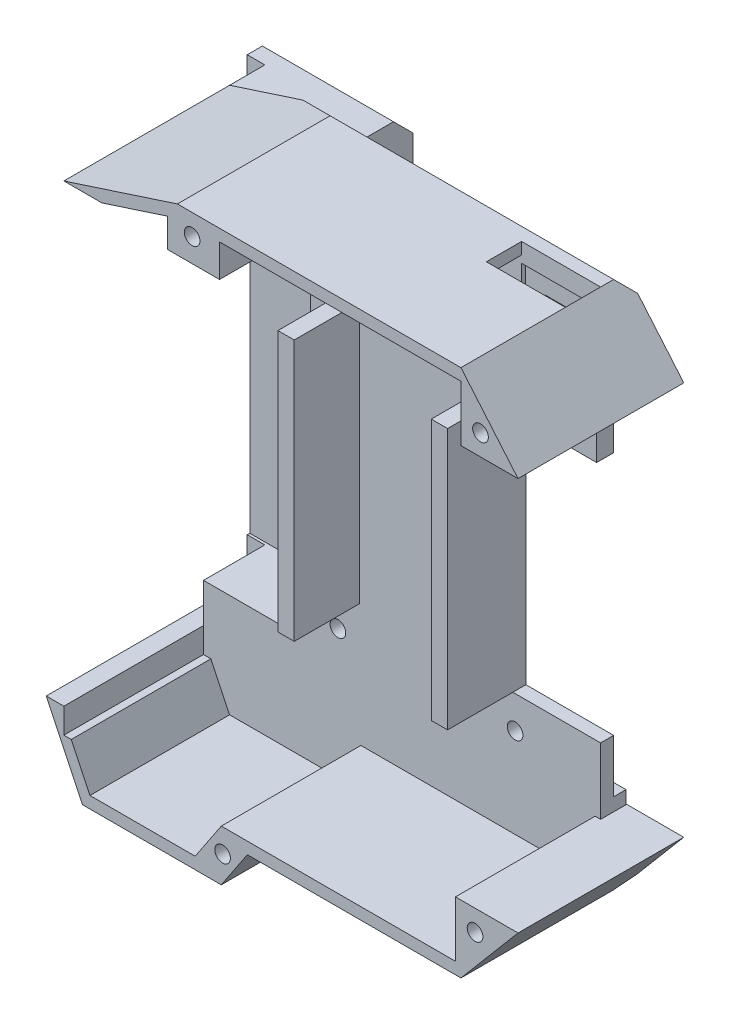
from build123d import *

# Parameters (mm, degrees)
SKETCH_1_W          = 33.55
SKETCH_1_H          = 60.3
SKETCH_1_R          = 1.2
EXTRUDE_1_DEPTH     = 2
SKETCH_2_W          = 2
SKETCH_2_H          = 60.3
EXTRUDE_2_DEPTH     = 9.9
SKETCH_3_W          = 9.9
SKETCH_3_H          = 2
EXTRUDE_3_DEPTH     = 1.9
SKETCH_4_W          = 10.719852834
SKETCH_4_H          = 56.3
SKETCH_4_W_2        = 2
SKETCH_4_H_2        = 60.3
EXTRUDE_5_DEPTH     = 3
SKETCH_6_W          = 14.719852834
SKETCH_6_H          = 4.7
EXTRUDE_6_DEPTH     = 3
SKETCH_7_W          = 9.4
SKETCH_7_H          = 6
SKETCH_7_R          = 1.5
EXTRUDE_7_DEPTH     = 14.4
EXTRUDE_8_DEPTH     = 17.1
EXTRUDE_9_DEPTH     = 8.35
SKETCH_10_W         = 43.45
SKETCH_10_H         = 4
EXTRUDE_10_DEPTH    = 8.35
CUT_EXTRUDE_START   = -0.6
CUT_EXTRUDE_1_DEPTH = 0.6
CUT_EXTRUDE_2_DEPTH = 0.6
SKETCH_13_W         = 43.45
SKETCH_13_H         = 4
EXTRUDE_11_DEPTH    = 2
SKETCH_14_W         = 43.45
SKETCH_14_H         = 4
EXTRUDE_12_DEPTH    = 2
EXTRUDE_13_DEPTH    = 4
SKETCH_16_W         = 2.5
SKETCH_16_H         = 40
EXTRUDE_14_DEPTH    = 10
SKETCH_17_W         = 4
SKETCH_17_H         = 5.65
EXTRUDE_15_DEPTH    = 17.4
EXTRUDE_16_DEPTH    = 4
SKETCH_19_W         = 1.8
SKETCH_19_H         = 1.8
EXTRUDE_17_DEPTH    = 21.4
SKETCH_20_W         = 12.1
SKETCH_20_H         = 1.8
EXTRUDE_18_DEPTH    = 16
EXTRUDE_START       = -4
EXTRUDE_22_DEPTH    = 25.4
EXTRUDE_23_DEPTH    = 25.4
CUT_EXTRUDE_3_DEPTH = 21.4
EXTRUDE_24_DEPTH    = 4
EXTRUDE_25_DEPTH    = 21.4
SKETCH_26_W         = 1.445945033
SKETCH_26_H         = 2.5
EXTRUDE_26_DEPTH    = 10
EXTRUDE_27_DEPTH    = 21.4
EXTRUDE_28_DEPTH    = 21.4
SKETCH_29_W         = 21.4
SKETCH_29_H         = 5
EXTRUDE_29_DEPTH    = 3
SKETCH_30_R         = 1.2
CUT_EXTRUDE_4_DEPTH = 12
SKETCH_31_W         = 13.445945033
SKETCH_31_H         = 37.5
SKETCH_31_W_2       = 7.004054967
SKETCH_31_H_2       = 40
CUT_EXTRUDE_5_DEPTH = 2
CUT_EXTRUDE_START_2 = -9.4
CUT_EXTRUDE_6_DEPTH = 9.4
CHAMFER_2_SIZE      = 2
CHAMFER_3_SIZE      = 3
CHAMFER_4_SIZE      = 3


with BuildPart() as part:
    # 草图1 → 凸台-拉伸1 (new body)
    with BuildSketch(Plane.XY):
        with Locations((-131.125, 30.15)):
            Rectangle(SKETCH_1_W, SKETCH_1_H)
        with Locations((-144.7, 5.2)):
            Circle(SKETCH_1_R, mode=Mode.SUBTRACT)
        with Locations((-117.55, 5.2)):
            Circle(SKETCH_1_R, mode=Mode.SUBTRACT)
        with Locations((-117.55, 55.1)):
            Circle(SKETCH_1_R, mode=Mode.SUBTRACT)
        with Locations((-144.7, 55.1)):
            Circle(SKETCH_1_R, mode=Mode.SUBTRACT)
    extrude(amount=EXTRUDE_1_DEPTH)

    # 草图2 → 凸台-拉伸2 (add)
    with BuildSketch(Plane(origin=(-114.35, 0, 0), x_dir=(0, 0, -1), z_dir=(1, 0, 0))):
        with Locations((-1, 30.15)):
            Rectangle(SKETCH_2_W, SKETCH_2_H)
    extrude(amount=EXTRUDE_2_DEPTH)

    # 草图3 → 凸台-拉伸3 (add)
    with BuildSketch(Plane(origin=(0, 0, 0), x_dir=(-1, 0, 0), z_dir=(0, 0, -1))):
        with Locations((109.4, 59.3)):
            Rectangle(SKETCH_3_W, SKETCH_3_H)
        with Locations((109.4, 1)):
            Rectangle(SKETCH_3_W, SKETCH_3_H)
    extrude(amount=EXTRUDE_3_DEPTH)

    # 草图4 → 凸台-拉伸5 (add)
    with BuildSketch(Plane.ZY.offset(147.9)):
        Polygon((0, 60.3), (-12.719852834, 60.3), (-12.719852834, 58.3), (-2, 58.3), (-2, 2), (-12.719852834, 2), (-12.719852834, 0), (0, 0), align=None)
        with Locations((-7.359926417, 30.15)):
            Rectangle(SKETCH_4_W, SKETCH_4_H)
        with Locations((1, 30.15)):
            Rectangle(SKETCH_4_W_2, SKETCH_4_H_2)
    extrude(amount=EXTRUDE_5_DEPTH)

    # 草图6 → 凸台-拉伸6 (add)
    with BuildSketch(Plane.ZY.offset(150.9)):
        with Locations((-5.359926417, 62.65)):
            Rectangle(SKETCH_6_W, SKETCH_6_H)
        with Locations((-5.359926417, -2.35)):
            Rectangle(SKETCH_6_W, SKETCH_6_H)
    extrude(amount=-EXTRUDE_6_DEPTH)

    # 草图7 → 凸台-拉伸7 (add)
    # profile 1 of 2: a face of its own
    with BuildSketch(Plane.ZY.offset(150.9)):
        with Locations((-2.7, 62)):
            Rectangle(SKETCH_7_W, SKETCH_7_H)
        with Locations(Location((-4.3, 61.9, 0), (0, 0, 180))):
            Circle(SKETCH_7_R, mode=Mode.SUBTRACT)
    # profile 2 of 2: a face of its own
    with BuildSketch(Plane.ZY.offset(150.9)):
        with Locations((-2.7, -1.7)):
            Rectangle(SKETCH_7_W, SKETCH_7_H)
        with Locations(Location((-4.3, -1.6, 0), (0, 0, 180))):
            Circle(SKETCH_7_R, mode=Mode.SUBTRACT)
    extrude(amount=EXTRUDE_7_DEPTH)

    # 草图8 → 凸台-拉伸8 (add)
    with BuildSketch(Plane.ZY.offset(150.9)):
        Polygon((-7.8, 59), (-7.8, 1.3), (-7.4, 1.3), (-7.4, -4.7), (-12.719852834, -4.7), (-12.719852834, 65), (-7.4, 65), (-7.4, 59), align=None)
    extrude(amount=EXTRUDE_8_DEPTH)

    # 草图9 → 凸台-拉伸9 (add)
    with BuildSketch(Plane(origin=(0, 60.3, 0), x_dir=(1, 0, 0), z_dir=(0, 1, 0))):
        Polygon((-114.35, 1.9), (-114.35, 0), (-147.9, 0), (-147.9, -2), (-104.45, -2), (-104.45, 1.9), align=None)
        Polygon((-114.35, 1.9), (-104.45, 1.9), (-104.45, 2), (-147.9, 2), (-147.9, 0), (-114.35, 0), align=None)
    extrude(amount=EXTRUDE_9_DEPTH)

    # 草图10 → 凸台-拉伸10 (add)
    with BuildSketch(Plane.XZ):
        with Locations((-126.175, 0)):
            Rectangle(SKETCH_10_W, SKETCH_10_H)
    extrude(amount=EXTRUDE_10_DEPTH)

    # 草图11 → 切除-拉伸1 (cut)
    with BuildSketch(Plane.XY.offset(2).offset(CUT_EXTRUDE_START)):
        with BuildLine():
            Line((-104.45, 51.65), (-104.45, 67.75))
            Line((-104.45, 67.75), (-116.55, 67.75))
            Line((-116.55, 67.75), (-116.55, 55.763324958))
            ThreePointArc((-116.55, 55.763324958), (-116.354567134, 55.204595711), (-116.45, 54.620416848))
            Line((-116.45, 54.620416848), (-116.45, 51.65))
            Line((-116.45, 51.65), (-104.45, 51.65))
        make_face()
    extrude(amount=CUT_EXTRUDE_1_DEPTH, mode=Mode.SUBTRACT)

    # 草图12 → 切除-拉伸2 (cut)
    with BuildSketch(Plane.XY.offset(1.4)):
        with BuildLine():
            Line((-113.374176728, 54.65), (-107.45, 54.65))
            Line((-107.45, 54.65), (-107.45, 64.75))
            Line((-107.45, 64.75), (-113.55, 64.75))
            Line((-113.55, 64.75), (-113.55, 56.380624847))
            ThreePointArc((-113.55, 56.380624847), (-113.371508988, 55.524514858), (-113.374176728, 54.65))
        make_face()
    extrude(amount=-CUT_EXTRUDE_2_DEPTH, mode=Mode.SUBTRACT)

    # 草图13 → 凸台-拉伸11 (add)
    with BuildSketch(Plane(origin=(0, 68.65, 0), x_dir=(1, 0, 0), z_dir=(0, 1, 0))):
        with Locations((-126.175, 0)):
            Rectangle(SKETCH_13_W, SKETCH_13_H)
    extrude(amount=EXTRUDE_11_DEPTH)

    # 草图14 → 凸台-拉伸12 (add)
    with BuildSketch(Plane.XZ.offset(8.35)):
        with Locations((-126.175, 0)):
            Rectangle(SKETCH_14_W, SKETCH_14_H)
    extrude(amount=EXTRUDE_12_DEPTH)

    # 草图15 → 凸台-拉伸13 (add)
    with BuildSketch(Plane.XY.offset(2)):
        Polygon((-147.9, 70.65), (-165.3, 65), (-147.9, 65), align=None)
    extrude(amount=-EXTRUDE_13_DEPTH)

    # 草图16 → 凸台-拉伸14 (add)
    with BuildSketch(Plane.XY.offset(2)):
        with Locations((-142.645945033, 30.15)):
            Rectangle(SKETCH_16_W, SKETCH_16_H)
        with Locations((-119.145945033, 30.15)):
            Rectangle(SKETCH_16_W, SKETCH_16_H)
    extrude(amount=EXTRUDE_14_DEPTH)

    # 草图17 → 凸台-拉伸15 (add)
    with BuildSketch(Plane.ZY.offset(147.9)):
        with Locations((0, -7.525)):
            Rectangle(SKETCH_17_W, SKETCH_17_H)
    extrude(amount=EXTRUDE_15_DEPTH)

    # 草图18 → 凸台-拉伸16 (add)
    with BuildSketch(Plane.XY.offset(2)):
        Polygon((-104.45, 67.75), (-104.45, 60.3), (-95.7, 60.3), (-104.45, 70.65), align=None)
        Polygon((-104.45, 0), (-104.45, -10.35), (-95.7, 0), align=None)
    extrude(amount=-EXTRUDE_16_DEPTH)

    # 草图19 → 凸台-拉伸17 (add)
    with BuildSketch(Plane.XY.offset(2)):
        Polygon((-165.3, 65), (-159.471717964, 65), (-147.615080796, 68.85), (-118.35, 68.85), (-118.35, 70.65), (-147.9, 70.65), align=None)
        with Locations((-117.45, 69.75)):
            Rectangle(SKETCH_19_W, SKETCH_19_H)
        Polygon((-95.7, 60.3), (-104.45, 70.65), (-104.45, 67.861945247), (-102.65, 65.73280239), (-99.57879025, 62.1), (-99.57879025, 60.3), align=None)
        Polygon((-105.285311989, -8.55), (-163.5, -8.55), (-165.3, -8.55), (-165.3, -10.35), (-104.45, -10.35), (-95.7, 0), (-99.57879025, 0), (-99.57879025, -1.8), align=None)
    extrude(amount=EXTRUDE_17_DEPTH)

    # 草图20 → 凸台-拉伸18 (add)
    with BuildSketch(Plane.XY.offset(23.4)):
        with Locations((-110.5, 69.75)):
            Rectangle(SKETCH_20_W, SKETCH_20_H)
    extrude(amount=-EXTRUDE_18_DEPTH)

    # 草图21 → 凸台-拉伸22 (add)
    with BuildSketch(Plane.XY.offset(2).offset(EXTRUDE_START)):
        Polygon((-165.3, -8.55), (-165.3, -4.7), (-168, -4.7), (-165.3, -10.35), align=None)
    extrude(amount=EXTRUDE_22_DEPTH)

    # 草图22 → 凸台-拉伸23 (add)
    with BuildSketch(Plane.XY.offset(23.4)):
        Polygon((-163.305030212, -10.35), (-165.3, -10.35), (-162.432743363, -16.35), (-141.174369577, -16.35), (-137.174369577, -10.35), (-138.374369577, -10.35), (-141.174369577, -14.55), (-161.297950566, -14.55), align=None)
    extrude(amount=-EXTRUDE_23_DEPTH)

    # 草图23 → 切除-拉伸3 (cut)
    with BuildSketch(Plane.XY.offset(23.4)):
        Polygon((-164.165207203, -8.55), (-163.305030212, -10.35), (-138.374369577, -10.35), (-137.174369577, -8.55), align=None)
    extrude(amount=-CUT_EXTRUDE_3_DEPTH, mode=Mode.SUBTRACT)

    # 草图24 → 凸台-拉伸24 (add)
    with BuildSketch(Plane(origin=(0, 0, -2), x_dir=(-1, 0, 0), z_dir=(0, 0, -1))):
        Polygon((141.174369577, -14.55), (161.297950566, -14.55), (163.305030212, -10.35), (138.374369577, -10.35), align=None)
    extrude(amount=-EXTRUDE_24_DEPTH)

    # 草图25 → 凸台-拉伸25 (add)
    with BuildSketch(Plane.XY.offset(2)):
        Polygon((-147.615080796, 68.85), (-149.4421323, 68.256733276), (-149.4421323, 63.85), (-144.4421323, 63.85), (-144.4421323, 68.85), align=None)
        Polygon((-141.174369577, -8.55), (-141.174369577, -14.55), (-137.174369577, -8.55), align=None)
        Polygon((-105.285311989, 0), (-104.45, 0), (-99.57879025, 0), (-99.57879025, -1.8), (-105.285311989, -8.55), align=None)
    extrude(amount=EXTRUDE_25_DEPTH)

    # 草图26 → 凸台-拉伸26 (add)
    with BuildSketch(Plane.XY.offset(2)):
        Polygon((-116.45, 50.15), (-116.45, 47.65), (-104.45, 47.65), (-104.45, 51.65), (-116.45, 51.65), align=None)
        with Locations((-117.172972517, 48.9)):
            Rectangle(SKETCH_26_W, SKETCH_26_H)
    extrude(amount=EXTRUDE_26_DEPTH)

    # 草图27 → 凸台-拉伸27 (add)
    with BuildSketch(Plane.XY.offset(2)):
        Polygon((-104.45, 67.861945247), (-104.45, 67.75), (-104.45, 60.3), (-99.57879025, 60.3), (-99.57879025, 62.1), align=None)
    extrude(amount=EXTRUDE_27_DEPTH)

    # 草图28 → 凸台-拉伸28 (add)
    with BuildSketch(Plane.XY.offset(23.4)):
        Polygon((-141.174369577, -14.55), (-141.174369577, -8.55), (-145.174369577, -14.55), align=None)
    extrude(amount=-EXTRUDE_28_DEPTH)

    # 草图29 → 凸台-拉伸29 (add)
    with BuildSketch(Plane(origin=(-144.4421323, 0, 0), x_dir=(0, 0, -1), z_dir=(1, 0, 0))):
        with Locations((-12.7, 66.35)):
            Rectangle(SKETCH_29_W, SKETCH_29_H)
    extrude(amount=EXTRUDE_29_DEPTH)

    # 草图30 → 切除-拉伸4 (cut)
    with BuildSketch(Plane.XY.offset(23.4)):
        with Locations((-102.285311989, -3.2)):
            Circle(SKETCH_30_R)
        with Locations((-101.45, 63.5)):
            Circle(SKETCH_30_R)
        with Locations((-140.974369577, -12.15)):
            Circle(SKETCH_30_R)
        with Locations((-145.6421323, 67.45)):
            Circle(SKETCH_30_R)
    extrude(amount=-CUT_EXTRUDE_4_DEPTH, mode=Mode.SUBTRACT)

    # 草图31 → 切除-拉伸5 (cut)
    with BuildSketch(Plane.XY.offset(2)):
        with Locations((-111.172972517, 28.9)):
            Rectangle(SKETCH_31_W, SKETCH_31_H)
        with Locations((-147.397972517, 30.15)):
            Rectangle(SKETCH_31_W_2, SKETCH_31_H_2)
    extrude(amount=-CUT_EXTRUDE_5_DEPTH, mode=Mode.SUBTRACT)

    # 草图32 → 切除-拉伸6 (cut)
    with BuildSketch(Plane.XY.offset(12).offset(CUT_EXTRUDE_START_2)):
        Polygon((-117.895945033, 50.15), (-117.895945033, 47.65), (-104.45, 47.65), (-104.45, 51.65), (-116.45, 51.65), (-116.45, 50.15), align=None)
    extrude(amount=CUT_EXTRUDE_6_DEPTH, mode=Mode.SUBTRACT)

    # 倒角2
    chamfer_2_edges = [part.edges().sort_by_distance(p)[0] for p in [
        (-126.175, 70.65, -2),
        (-120.812184789, -10.35, -2),
        (-151.80355647, -16.35, -2),
    ]]
    chamfer(chamfer_2_edges, length=CHAMFER_2_SIZE)

    # 倒角3
    chamfer_3_edges = [part.edges().sort_by_distance(p)[0] for p in [
        (-157.95, -4.7, -12.719852834),
        (-157.95, 65, -12.719852834),
    ]]
    chamfer(chamfer_3_edges, length=CHAMFER_3_SIZE)

    # 倒角4
    chamfer_4_edges = [part.edges().sort_by_distance(p)[0] for p in [
        (-168, 30.15, -12.719852834),
    ]]
    chamfer(chamfer_4_edges, length=CHAMFER_4_SIZE)


solid = part.part
